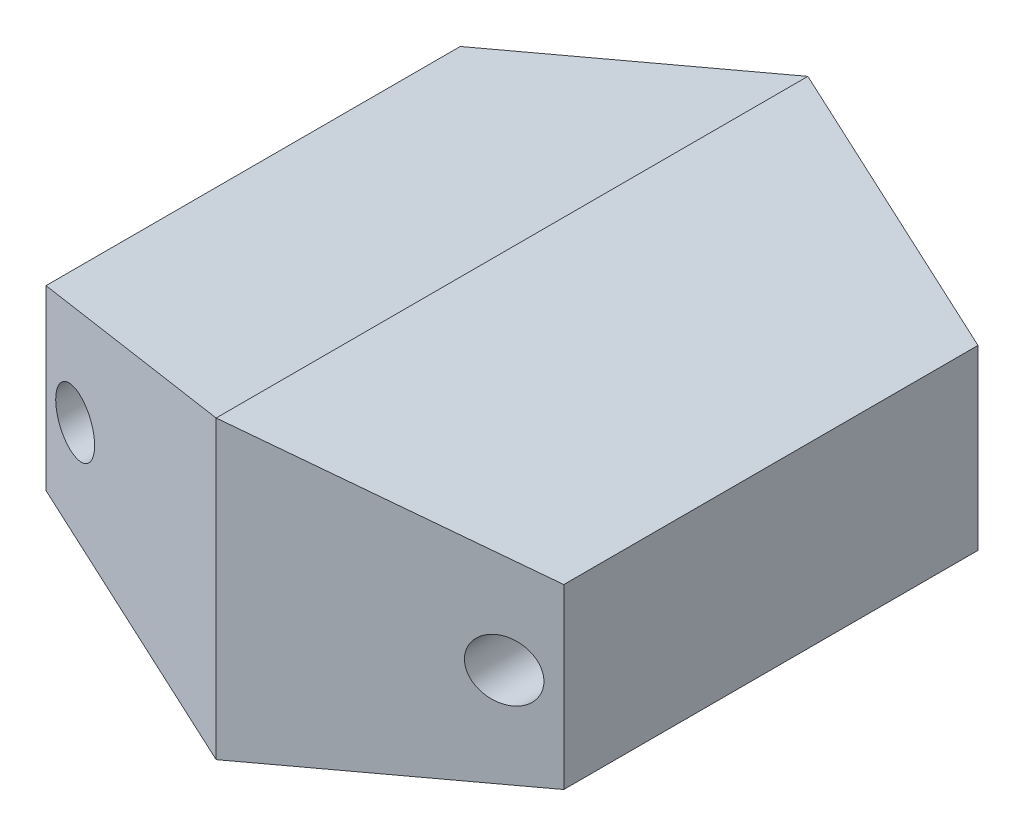
from build123d import *

# Parameters (mm, degrees)
SKETCH1_W               = 35
SKETCH1_H               = 20
BOSS_EXTRUDE1_DEPTH     = 40
CUT_EXTRUDE1_DEPTH      = 40
CUT_EXTRUDE2_DEPTH      = 45.791182168
CUT_EXTRUDE2_DEPTH_BACK = 45.791182168
SKETCH6_R               = 2
CUT_EXTRUDE3_DEPTH      = 45.791182168


with BuildPart() as part:
    # Sketch1 → Boss-Extrude1 (new body)
    with BuildSketch(Plane.XY):
        Rectangle(SKETCH1_W, SKETCH1_H)
    extrude(amount=BOSS_EXTRUDE1_DEPTH)

    # Sketch3 → Cut-Extrude1 (cut)
    with BuildSketch(Plane.XY.offset(40)):
        Polygon((-17.5, 10), (-17.5, 6), (0, 10), align=None)
        Polygon((17.5, 10), (0, 10), (17.5, 6), align=None)
        Polygon((17.5, -6), (0, -10), (17.5, -10), align=None)
        Polygon((0, -10), (-17.5, -6), (-17.5, -10), align=None)
    extrude(amount=-CUT_EXTRUDE1_DEPTH, mode=Mode.SUBTRACT)

    # Sketch5 → Cut-Extrude2 (cut, two sides: drawn at the far end of the back side and taken through both)
    with BuildSketch(Plane(origin=(0, 0, 0), x_dir=(1, 0, 0), z_dir=(0, 1, 0)).offset(-CUT_EXTRUDE2_DEPTH_BACK)):
        Polygon((-17.5, 0), (0, 0), (-17.5, -6), align=None)
        Polygon((17.5, -6), (17.5, 0), (0, 0), align=None)
        Polygon((17.5, -40), (0, -40), (17.5, -34), align=None)
        Polygon((-17.5, -40), (-17.5, -34), (0, -40), align=None)
    extrude(amount=CUT_EXTRUDE2_DEPTH + CUT_EXTRUDE2_DEPTH_BACK, mode=Mode.SUBTRACT)

    # Sketch6 → Cut-Extrude3 (cut, through all)
    with BuildSketch(Plane.XY):
        with Locations(Location((-14.5, 0, 0), (0, 0, 180))):
            Circle(SKETCH6_R)
        with Locations(Location((14.5, 0, 0), (0, 0, 180))):
            Circle(SKETCH6_R)
    extrude(amount=CUT_EXTRUDE3_DEPTH, mode=Mode.SUBTRACT)


solid = part.part
